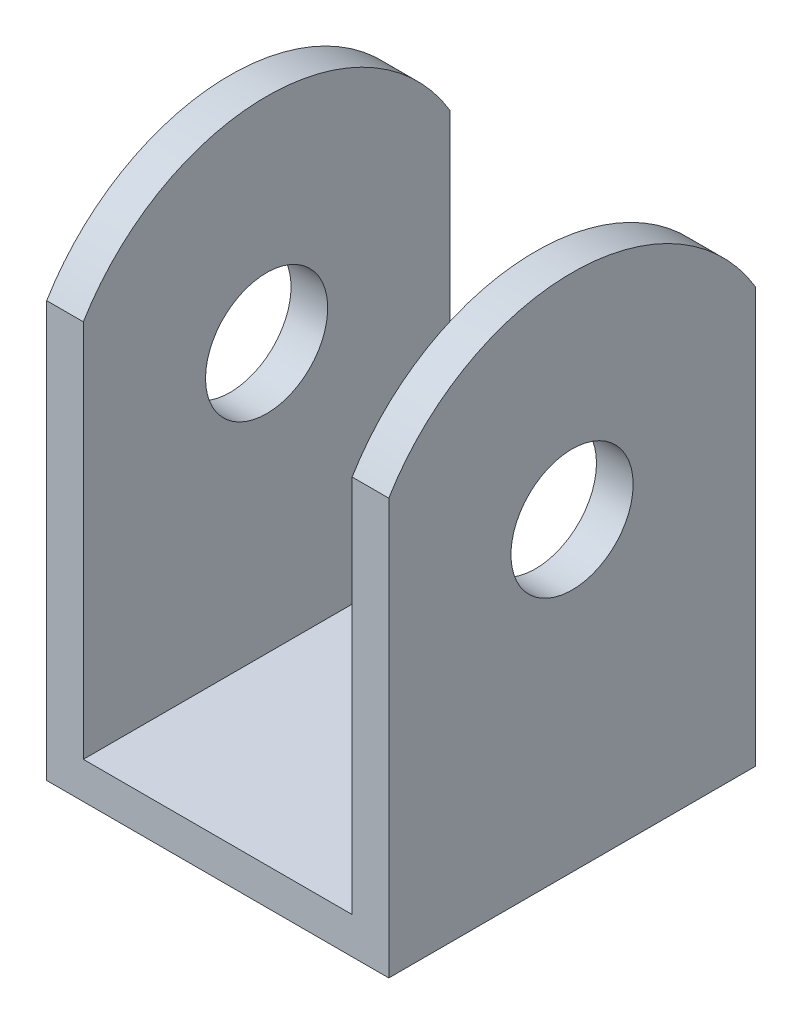
from build123d import *

# Parameters (mm, degrees)
SKETCH1_W           = 22
SKETCH1_H           = 35
BOSS_EXTRUDE1_DEPTH = 3
SKETCH2_W           = 35
SKETCH2_H           = 3
BOSS_EXTRUDE6_DEPTH = 3
BOSS_EXTRUDE7_START = 3
SKETCH4_W           = 35
SKETCH4_H           = 3
BOSS_EXTRUDE7_DEPTH = 3
SKETCH5_W           = 28
SKETCH5_H           = 2.5
CUT_EXTRUDE1_DEPTH  = 50


with BuildPart() as part:
    # Sketch1 → Boss-Extrude1 (new body)
    with BuildSketch(Plane(origin=(0, 0, 0), x_dir=(1, 0, 0), z_dir=(0, 1, 0))):
        with Locations((-45.186046512, -0.081395349)):
            Rectangle(SKETCH1_W, SKETCH1_H)
    extrude(amount=BOSS_EXTRUDE1_DEPTH)

    # Sketch2 → Boss-Extrude6 (add)
    with BuildSketch(Plane(origin=(-34.186046512, 0, 0), x_dir=(0, 0, -1), z_dir=(1, 0, 0))):
        with BuildLine():
            ThreePointArc((17.418604651, 25), (-0.081395349, 42.5), (-17.581395349, 25))
            Line((-17.581395349, 25), (-5.081395349, 25))
            ThreePointArc((-5.081395349, 25), (-0.081395349, 30), (4.918604651, 25))
            Line((4.918604651, 25), (17.418604651, 25))
        make_face()
        with BuildLine():
            Line((-5.081395349, 25), (-17.581395349, 25))
            ThreePointArc((-17.581395349, 25), (-0.081395349, 7.5), (17.418604651, 25))
            Line((17.418604651, 25), (4.918604651, 25))
            ThreePointArc((4.918604651, 25), (-0.081395349, 20), (-5.081395349, 25))
        make_face()
        with BuildLine():
            Line((-17.581395349, 25), (-17.581395349, 3))
            Line((-17.581395349, 3), (17.418604651, 3))
            Line((17.418604651, 3), (17.418604651, 25))
            ThreePointArc((17.418604651, 25), (-0.081395349, 7.5), (-17.581395349, 25))
        make_face()
        with Locations((-0.081395349, 1.5)):
            Rectangle(SKETCH2_W, SKETCH2_H)
    extrude(amount=BOSS_EXTRUDE6_DEPTH)

    # Sketch4 → Boss-Extrude7 (add)
    with BuildSketch(Plane.ZY.offset(56.186046512).offset(BOSS_EXTRUDE7_START)):
        with BuildLine():
            ThreePointArc((17.581395349, 25), (0.081395349, 42.5), (-17.418604651, 25))
            Line((-17.418604651, 25), (-4.918604651, 25))
            ThreePointArc((-4.918604651, 25), (0.081395349, 30), (5.081395349, 25))
            Line((5.081395349, 25), (17.581395349, 25))
        make_face()
        with BuildLine():
            Line((-4.918604651, 25), (-17.418604651, 25))
            ThreePointArc((-17.418604651, 25), (0.081395349, 7.5), (17.581395349, 25))
            Line((17.581395349, 25), (5.081395349, 25))
            ThreePointArc((5.081395349, 25), (0.081395349, 20), (-4.918604651, 25))
        make_face()
        with BuildLine():
            Line((-17.418604651, 25), (-17.418604651, 3))
            Line((-17.418604651, 3), (17.581395349, 3))
            Line((17.581395349, 3), (17.581395349, 25))
            ThreePointArc((17.581395349, 25), (0.081395349, 7.5), (-17.418604651, 25))
        make_face()
        with Locations((0.081395349, 1.5)):
            Rectangle(SKETCH4_W, SKETCH4_H)
    extrude(amount=-BOSS_EXTRUDE7_DEPTH)

    # Sketch5 → Cut-Extrude1 (cut)
    with BuildSketch(Plane.XZ):
        with Locations((-45.186046512, 16.331395349)):
            Rectangle(SKETCH5_W, SKETCH5_H)
        with Locations((-45.186046512, -16.168604651)):
            Rectangle(SKETCH5_W, SKETCH5_H)
    extrude(amount=-CUT_EXTRUDE1_DEPTH, mode=Mode.SUBTRACT)


solid = part.part
